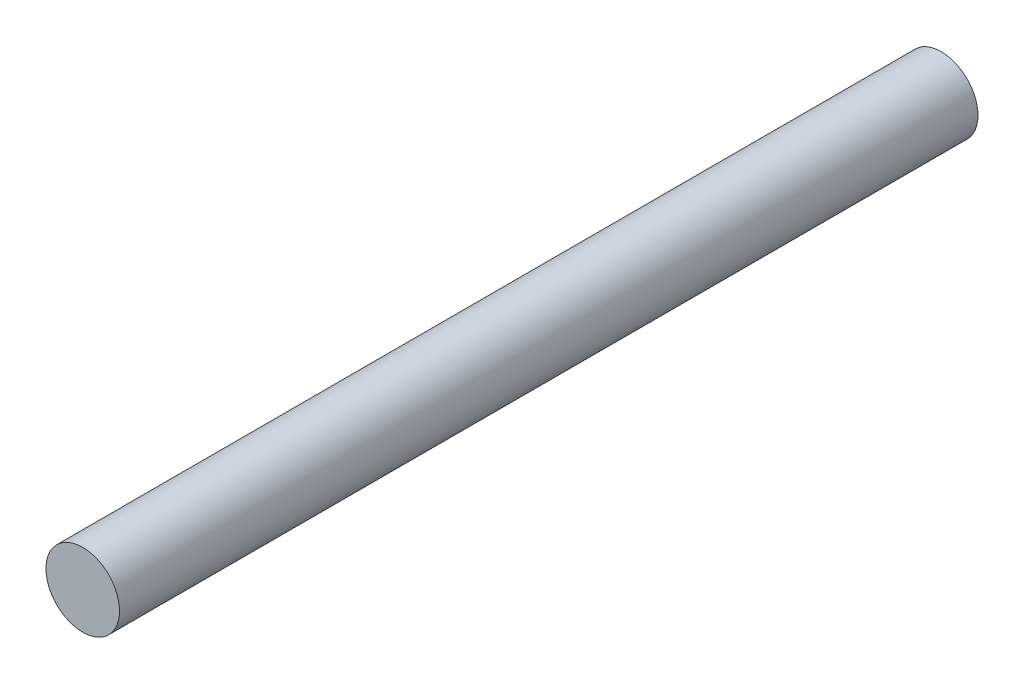
from build123d import *

# Parameters (mm, degrees)
SKETCH1_R           = 1.5
BOSS_EXTRUDE1_DEPTH = 35


with BuildPart() as part:
    # Sketch1 → Boss-Extrude1 (new body)
    with BuildSketch(Plane.XY):
        Circle(SKETCH1_R)
    extrude(amount=BOSS_EXTRUDE1_DEPTH)


solid = part.part
